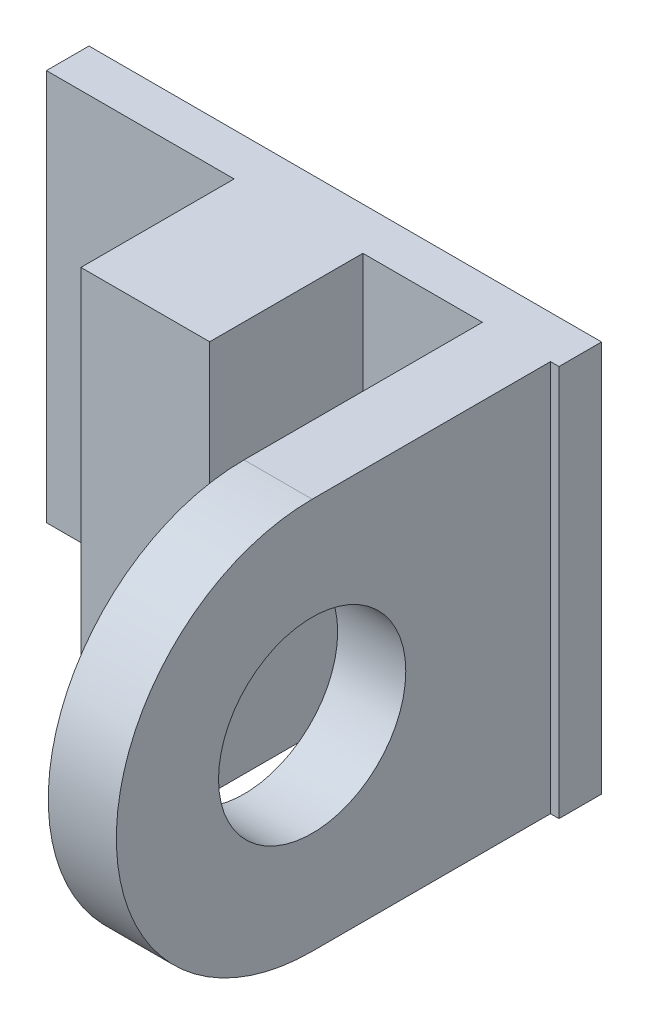
from build123d import *

# Parameters (mm, degrees)
ESQUISSE1_W        = 60.213993324
ESQUISSE1_H        = 46
BOSS_EXTRU_1_DEPTH = 5
ESQUISSE2_W        = 8
ESQUISSE2_H        = 46
ESQUISSE2_W_2      = 15.12622911
BOSS_EXTRU_2_DEPTH = 6
ESQUISSE8_R        = 11
BOSS_EXTRU_4_DEPTH = 8
ESQUISSE10_W       = 12
ESQUISSE10_H       = 46
BOSS_EXTRU_5_DEPTH = 15.12622911


with BuildPart() as part:
    # Esquisse1 → Boss.-Extru.1 (new body)
    with BuildSketch(Plane.XY):
        with Locations((-16.106996662, 0)):
            Rectangle(ESQUISSE1_W, ESQUISSE1_H)
    extrude(amount=BOSS_EXTRU_1_DEPTH)

    # Esquisse2 → Boss.-Extru.2 (add)
    with BuildSketch(Plane.XY.offset(5)):
        with Locations((9, 0)):
            Rectangle(ESQUISSE2_W, ESQUISSE2_H)
        with Locations((-16.60101476, 0)):
            Rectangle(ESQUISSE2_W_2, ESQUISSE2_H)
    extrude(amount=BOSS_EXTRU_2_DEPTH)

    # Esquisse8 → Boss.-Extru.4 (add)
    with BuildSketch(Plane.ZY.offset(-5)):
        with BuildLine():
            Line((33, -23), (11, -23))
            Line((11, -23), (11, 23))
            Line((11, 23), (33, 23))
            ThreePointArc((33, 23), (56, 0), (33, -23))
        make_face()
        with Locations((33, 0)):
            Circle(ESQUISSE8_R, mode=Mode.SUBTRACT)
    extrude(amount=-BOSS_EXTRU_4_DEPTH)

    # Esquisse10 → Boss.-Extru.5 (add)
    with BuildSketch(Plane.ZY.offset(24.164129315)):
        with Locations((17, 0)):
            Rectangle(ESQUISSE10_W, ESQUISSE10_H)
    extrude(amount=-BOSS_EXTRU_5_DEPTH)


solid = part.part
